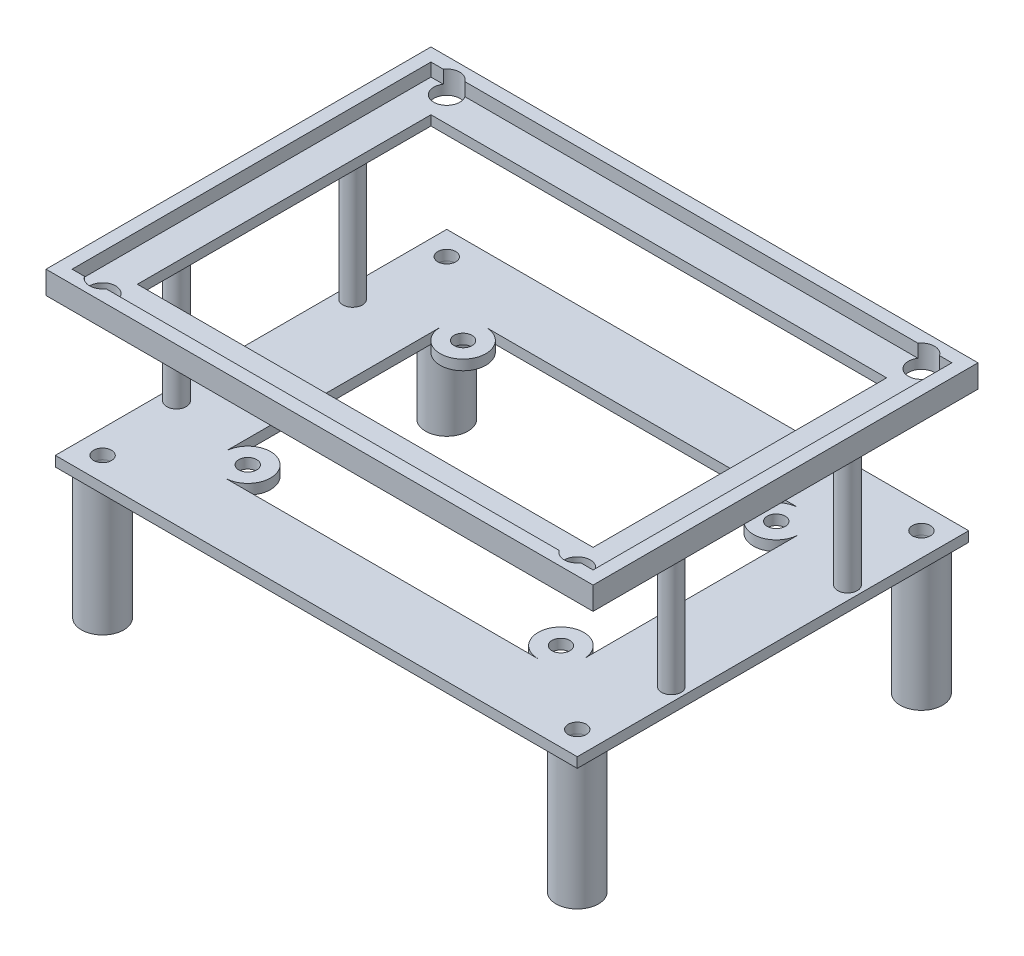
from build123d import *

# Parameters (mm, degrees)
SKETCH1_W             = 80
SKETCH1_H             = 60
SKETCH1_R             = 1.375
BOSS_EXTRUDE1_DEPTH   = 1.55
SKETCH14_R            = 1.375
CUT_EXTRUDE6_DEPTH    = 51.024019231
SKETCH15_W            = 83.85
SKETCH15_H            = 59
SKETCH15_W_2          = 79.85
SKETCH15_H_2          = 55
BOSS_EXTRUDE3_DEPTH   = 3.5
SKETCH16_W            = 79.85
SKETCH16_H            = 55
BOSS_EXTRUDE4_DEPTH   = 1.5
SKETCH17_W            = 69.85
SKETCH17_H            = 45
CUT_EXTRUDE7_DEPTH    = 7.5
SKETCH18_R            = 1.5
BOSS_EXTRUDE5_DEPTH   = 20
BOSS_EXTRUDE7_START   = -21.55
SKETCH19_R            = 3.25
SKETCH19_R_2          = 1.375
BOSS_EXTRUDE7_DEPTH   = 20
BOSS_EXTRUDE7_2_DEPTH = 20
BOSS_EXTRUDE7_3_DEPTH = 20
BOSS_EXTRUDE7_4_DEPTH = 20
SKETCH21_R            = 2
CUT_EXTRUDE11_DEPTH   = 32


with BuildPart() as part:
    # Sketch1 → Boss-Extrude1 (new body)
    with BuildSketch(Plane(origin=(0, 0, 0), x_dir=(1, 0, 0), z_dir=(0, 1, 0))):
        Rectangle(SKETCH1_W, SKETCH1_H)
        with Locations(Location((-36.375, 26.375, 0), (0, 0, 90))):
            Circle(SKETCH1_R, mode=Mode.SUBTRACT)
        with Locations(Location((-36.375, -26.375, 0), (0, 0, 90))):
            Circle(SKETCH1_R, mode=Mode.SUBTRACT)
        with Locations(Location((36.375, -26.375, 0), (0, 0, 90))):
            Circle(SKETCH1_R, mode=Mode.SUBTRACT)
        with Locations(Location((36.375, 26.375, 0), (0, 0, 90))):
            Circle(SKETCH1_R, mode=Mode.SUBTRACT)
    extrude(amount=BOSS_EXTRUDE1_DEPTH)

    # Sketch14 → Cut-Extrude6 (cut, through all)
    with BuildSketch(Plane(origin=(0, 1.55, 0), x_dir=(1, 0, 0), z_dir=(0, 1, 0))):
        with Locations(Location((-24, 16.5, 0), (0, 0, 270))):
            Circle(SKETCH14_R)
        with Locations(Location((24, 16.5, 0), (0, 0, 270))):
            Circle(SKETCH14_R)
        with Locations(Location((24, -16.5, 0), (0, 0, 270))):
            Circle(SKETCH14_R)
        with Locations(Location((-24, -16.5, 0), (0, 0, 270))):
            Circle(SKETCH14_R)
        with BuildLine():
            Line((-27.5, 16.5), (-27.5, -16.5))
            ThreePointArc((-27.5, -16.5), (-21.525126266, -14.025126266), (-24, -20))
            Line((-24, -20), (24, -20))
            ThreePointArc((24, -20), (21.525126266, -14.025126266), (27.5, -16.5))
            Line((27.5, -16.5), (27.5, 16.5))
            ThreePointArc((27.5, 16.5), (21.525126266, 14.025126266), (24, 20))
            Line((24, 20), (-24, 20))
            ThreePointArc((-24, 20), (-21.525126266, 14.025126266), (-27.5, 16.5))
        make_face()
    extrude(amount=-CUT_EXTRUDE6_DEPTH, mode=Mode.SUBTRACT)



with BuildPart() as body_2:
    # Sketch15 → Boss-Extrude3 (new body)
    with BuildSketch(Plane(origin=(0, 21.55, 0), x_dir=(1, 0, 0), z_dir=(0, 1, 0))):
        Rectangle(SKETCH15_W, SKETCH15_H)
        Rectangle(SKETCH15_W_2, SKETCH15_H_2, mode=Mode.SUBTRACT)
    extrude(amount=BOSS_EXTRUDE3_DEPTH)

    # Sketch16 → Boss-Extrude4 (add)
    with BuildSketch(Plane(origin=(0, 21.55, 0), x_dir=(1, 0, 0), z_dir=(0, 1, 0))):
        Rectangle(SKETCH16_W, SKETCH16_H)
    extrude(amount=BOSS_EXTRUDE4_DEPTH)

    # Sketch17 → Cut-Extrude7 (cut)
    with BuildSketch(Plane(origin=(0, 23.05, 0), x_dir=(1, 0, 0), z_dir=(0, 1, 0))):
        Rectangle(SKETCH17_W, SKETCH17_H)
    extrude(amount=-CUT_EXTRUDE7_DEPTH, mode=Mode.SUBTRACT)


with BuildPart() as part_1:
    add(part.part)

    add(body_2.part)  # Boss-Extrude5 merges body 2
    # Sketch18 → Boss-Extrude5 (add)
    with BuildSketch(Plane(origin=(0, 21.55, 0), x_dir=(1, 0, 0), z_dir=(0, 1, 0))):
        with Locations(Location((-37.925, -13.5, 0), (0, 0, 270))):
            Circle(SKETCH18_R)
        with Locations(Location((37.925, -13.5, 0), (0, 0, 90))):
            Circle(SKETCH18_R)
        with Locations(Location((37.925, 13.5, 0), (0, 0, 270))):
            Circle(SKETCH18_R)
        with Locations(Location((-37.925, 13.5, 0), (0, 0, 90))):
            Circle(SKETCH18_R)
    extrude(amount=-BOSS_EXTRUDE5_DEPTH)

    # Sketch21 → Cut-Extrude11 (cut)
    with BuildSketch(Plane(origin=(0, 21.55, 0), x_dir=(1, 0, 0), z_dir=(0, 1, 0))):
        with Locations(Location((-36.375, 26.375, 0), (0, 0, 145.771133672))):
            Circle(SKETCH21_R)
        with Locations(Location((36.375, 26.375, 0), (0, 0, 90))):
            Circle(SKETCH21_R)
        with Locations(Location((36.375, -26.375, 0), (0, 0, 325.771133672))):
            Circle(SKETCH21_R)
        with Locations(Location((-36.375, -26.375, 0), (0, 0, 90))):
            Circle(SKETCH21_R)
    extrude(amount=CUT_EXTRUDE11_DEPTH, mode=Mode.SUBTRACT)


with BuildPart() as body_2_2:
    # Sketch19 → Boss-Extrude7 (new body)
    with BuildSketch(Plane(origin=(0, 21.55, 0), x_dir=(1, 0, 0), z_dir=(0, 1, 0)).offset(BOSS_EXTRUDE7_START)):
        with Locations(Location((-36.375, -26.375, 0), (0, 0, 90))):
            Circle(SKETCH19_R)
        with Locations(Location((-36.375, -26.375, 0), (0, 0, 90))):
            Circle(SKETCH19_R_2, mode=Mode.SUBTRACT)
    extrude(amount=-BOSS_EXTRUDE7_DEPTH)


with BuildPart() as body_3:
    # Sketch19 → Boss-Extrude7 2 (new body)
    with BuildSketch(Plane(origin=(0, 21.55, 0), x_dir=(1, 0, 0), z_dir=(0, 1, 0)).offset(BOSS_EXTRUDE7_START)):
        with Locations(Location((36.375, -26.375, 0), (0, 0, 90))):
            Circle(SKETCH19_R)
        with Locations(Location((36.375, -26.375, 0), (0, 0, 90))):
            Circle(SKETCH19_R_2, mode=Mode.SUBTRACT)
    extrude(amount=-BOSS_EXTRUDE7_2_DEPTH)


with BuildPart() as body_4:
    # Sketch19 → Boss-Extrude7 3 (new body)
    with BuildSketch(Plane(origin=(0, 21.55, 0), x_dir=(1, 0, 0), z_dir=(0, 1, 0)).offset(BOSS_EXTRUDE7_START)):
        with Locations(Location((36.375, 26.375, 0), (0, 0, 90))):
            Circle(SKETCH19_R)
        with Locations(Location((36.375, 26.375, 0), (0, 0, 90))):
            Circle(SKETCH19_R_2, mode=Mode.SUBTRACT)
    extrude(amount=-BOSS_EXTRUDE7_3_DEPTH)


with BuildPart() as body_5:
    # Sketch19 → Boss-Extrude7 4 (new body)
    with BuildSketch(Plane(origin=(0, 21.55, 0), x_dir=(1, 0, 0), z_dir=(0, 1, 0)).offset(BOSS_EXTRUDE7_START)):
        with Locations(Location((-36.375, 26.375, 0), (0, 0, 90))):
            Circle(SKETCH19_R)
        with Locations(Location((-36.375, 26.375, 0), (0, 0, 90))):
            Circle(SKETCH19_R_2, mode=Mode.SUBTRACT)
    extrude(amount=-BOSS_EXTRUDE7_4_DEPTH)


solid = Compound([part_1.part, body_2_2.part, body_3.part, body_4.part, body_5.part])
